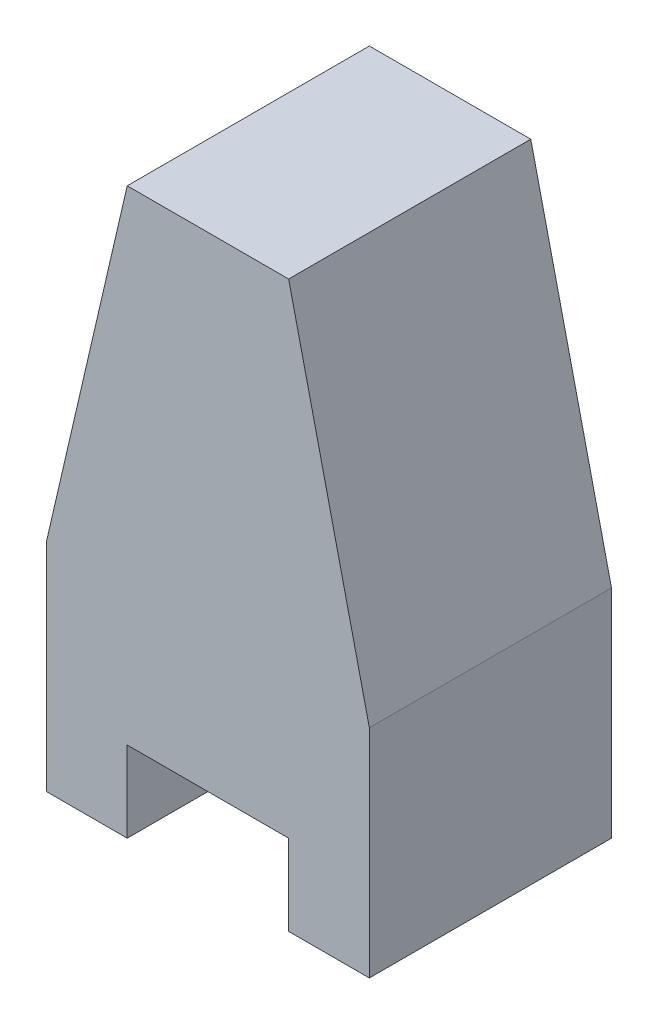
from build123d import *

# Parameters (mm, degrees)
BOSS_EXTRUDE1_DEPTH = 15


with BuildPart() as part:
    # Sketch4 → Boss-Extrude1 (new body)
    with BuildSketch(Plane.XY):
        Polygon((-20, -9.073426573), (-15, 12.5), (-5, 12.5), (0, -9.073426573), (0, -22.5), (-5, -22.5), (-5, -17.5), (-15, -17.5), (-15, -22.5), (-20, -22.5), align=None)
    extrude(amount=BOSS_EXTRUDE1_DEPTH)


solid = part.part
